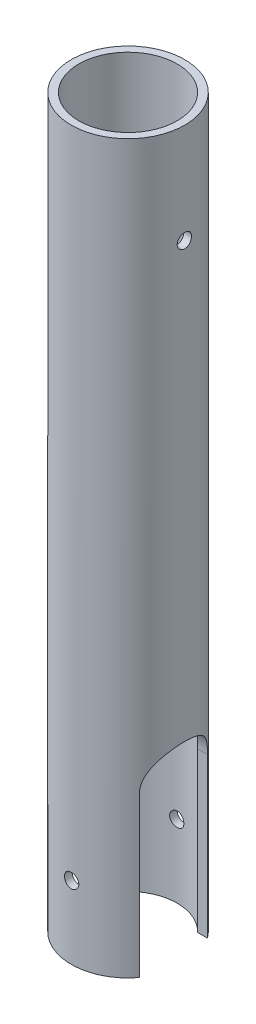
from build123d import *

# Parameters (mm, degrees)
SKETCH1_R               = 15.875
SKETCH1_R_2             = 13.7668
BOSS_EXTRUDE1_DEPTH     = 203.2
CUT_EXTRUDE2_DEPTH      = 205.436472406
CUT_EXTRUDE2_DEPTH_BACK = 205.436472406
SKETCH4_R               = 2
CUT_EXTRUDE3_DEPTH      = 205.436472522
CUT_EXTRUDE3_DEPTH_BACK = 205.436472522
SKETCH3_R               = 2
CUT_EXTRUDE4_DEPTH      = 205.436472522
CUT_EXTRUDE5_DEPTH      = 205.436472522


with BuildPart() as part:
    # Sketch1 → Boss-Extrude1 (new body)
    with BuildSketch(Plane(origin=(0, 0, 0), x_dir=(1, 0, 0), z_dir=(0, 1, 0))):
        with Locations(Location((0, 0, 0), (0, 0, 270))):
            Circle(SKETCH1_R)
        with Locations(Location((0, 0, 0), (0, 0, 270))):
            Circle(SKETCH1_R_2, mode=Mode.SUBTRACT)
    extrude(amount=BOSS_EXTRUDE1_DEPTH)

    # Sketch4 → Cut-Extrude2 (cut, two sides: drawn at the far end of the back side and taken through both)
    with BuildSketch(Plane.XY.offset(-CUT_EXTRUDE2_DEPTH_BACK)):
        with Locations((0, 20.32)):
            Circle(SKETCH4_R)
    extrude(amount=CUT_EXTRUDE2_DEPTH + CUT_EXTRUDE2_DEPTH_BACK, mode=Mode.SUBTRACT)

    # Sketch3 → Cut-Extrude3 (cut, two sides: drawn at the far end of the back side and taken through both)
    with BuildSketch(Plane(origin=(0, 0, 0), x_dir=(0, 0, -1), z_dir=(1, 0, 0)).offset(-CUT_EXTRUDE3_DEPTH_BACK)):
        with Locations((0, 175.26)):
            Circle(SKETCH3_R)
    extrude(amount=CUT_EXTRUDE3_DEPTH + CUT_EXTRUDE3_DEPTH_BACK, mode=Mode.SUBTRACT)

    # Sketch5 → Cut-Extrude4 (cut, through all)
    with BuildSketch(Plane(origin=(0, 0, 0), x_dir=(0, 0, -1), z_dir=(1, 0, 0))):
        with BuildLine():
            Line((9.525, 44.45), (9.525, 0))
            Line((9.525, 0), (-9.525, 0))
            Line((-9.525, 0), (-9.525, 44.45))
            ThreePointArc((-9.525, 44.45), (0, 53.975), (9.525, 44.45))
        make_face()
    extrude(amount=CUT_EXTRUDE4_DEPTH, mode=Mode.SUBTRACT)

    # Sketch6 → Cut-Extrude5 (cut, through all)
    with BuildSketch(Plane(origin=(0, 0, 0), x_dir=(0, 0, -1), z_dir=(1, 0, 0))):
        with BuildLine():
            Line((-9.525, 0), (9.525, 0))
            Line((9.525, 0), (9.525, 12.7))
            ThreePointArc((9.525, 12.7), (0, 22.225), (-9.525, 12.7))
            Line((-9.525, 12.7), (-9.525, 0))
        make_face()
    extrude(amount=-CUT_EXTRUDE5_DEPTH, mode=Mode.SUBTRACT)


solid = part.part
